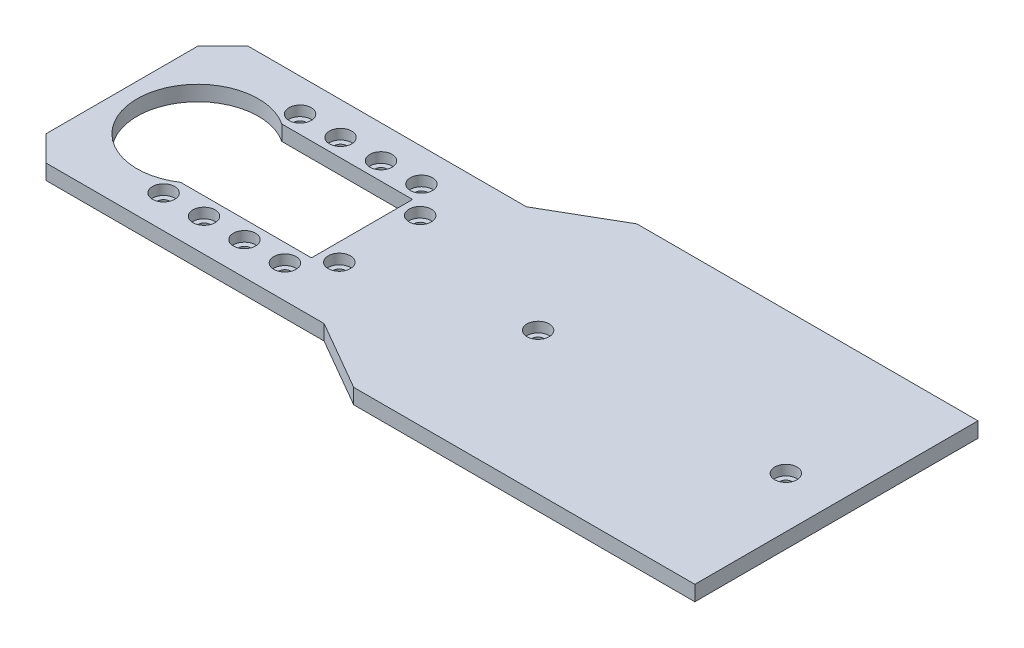
from build123d import *

# Parameters (mm, degrees)
EXTRUDE_1_DEPTH              = 3
CUT_EXTRUDE_1_REACH          = 217.134
HOLE_WIZARD_M2_2_D           = 2.4
HOLE_WIZARD_M2_2_CBORE_D     = 4.4
HOLE_WIZARD_M2_2_CBORE_DEPTH = 2
CUT_EXTRUDE_2_REACH          = 217.134
HOLE_WIZARD_M2_3_D           = 2.4
HOLE_WIZARD_M2_3_CBORE_D     = 4.4
HOLE_WIZARD_M2_3_CBORE_DEPTH = 2
MIRROR_7_COPY_1_REACH        = 217.134
MIRROR_7_COPY_2_D            = 2.4
MIRROR_7_COPY_2_CBORE_D      = 4.4
MIRROR_7_COPY_2_CBORE_DEPTH  = 2
CUT_EXTRUDE_3_REACH          = 217.134
SKETCH_18_W                  = 20
SKETCH_18_H                  = 10
HOLE_WIZARD_M2_4_D           = 2.4
HOLE_WIZARD_M2_4_CBORE_D     = 4.4
HOLE_WIZARD_M2_4_CBORE_DEPTH = 2
HOLE_WIZARD_M2_5_D           = 2.4
HOLE_WIZARD_M2_5_CBORE_D     = 4.4
HOLE_WIZARD_M2_5_CBORE_DEPTH = 2
HOLE_WIZARD_M2_6_D           = 2.4
HOLE_WIZARD_M2_6_CBORE_D     = 4.4
HOLE_WIZARD_M2_6_CBORE_DEPTH = 2
SKETCH_24_W                  = 20
SKETCH_24_H                  = 56
CUT_EXTRUDE_4_DEPTH          = 10
HOLE_WIZARD_M2_7_D           = 2.4
HOLE_WIZARD_M2_7_CBORE_D     = 4.4
HOLE_WIZARD_M2_7_CBORE_DEPTH = 2
SKETCH_26_OUTSIDE_W          = 390.69
SKETCH_26_OUTSIDE_H          = 393.83
SKETCH_26_OUTSIDE_W_2        = 151.320508076
SKETCH_26_OUTSIDE_H_2        = 56
CUT_EXTRUDE_6_DEPTH          = 10


with BuildPart() as part:
    # 草图1 → 凸台-拉伸1 (new body)
    with BuildSketch(Plane(origin=(0, 0, 0), x_dir=(1, 0, 0), z_dir=(0, 1, 0))):
        Polygon((-45.715728753, 114), (45.715728753, 114), (84.606601718, 152.890872965), (91.67766953, 152.890872965), (112.890872965, 131.67766953), (112.890872965, 124.606601718), (74, 85.715728753), (74, 30), (91.320508076, 20), (146.320508076, 20), (151.320508076, 15), (151.320508076, -15), (146.320508076, -20), (91.320508076, -20), (74, -30), (74, -85.715728753), (112.890872965, -124.606601718), (112.890872965, -131.67766953), (91.67766953, -152.890872965), (84.606601718, -152.890872965), (45.715728753, -114), (-45.715728753, -114), (-84.606601718, -152.890872965), (-91.67766953, -152.890872965), (-112.890872965, -131.67766953), (-112.890872965, -124.606601718), (-74, -85.715728753), (-74, -30), (-91.320508076, -20), (-146.320508076, -20), (-151.320508076, -15), (-151.320508076, 15), (-146.320508076, 20), (-91.320508076, 20), (-74, 30), (-74, 85.715728753), (-112.890872965, 124.606601718), (-112.890872965, 131.67766953), (-91.67766953, 152.890872965), (-84.606601718, 152.890872965), align=None)
    extrude(amount=EXTRUDE_1_DEPTH)

    # 草图2 → 切除-拉伸1 (cut, up to next)
    with BuildSketch(Plane(origin=(0, 3, 0), x_dir=(1, 0, 0), z_dir=(0, 1, 0)), mode=Mode.PRIVATE) as cut_extrude_1_sk1:
        with BuildLine():
            Line((103.820508076, -10), (103.820508076, 10))
            Line((103.820508076, 10), (129.687258495, 10))
            ThreePointArc((129.687258495, 10), (148.320508076, 0), (129.687258495, -10))
            Line((129.687258495, -10), (103.820508076, -10))
        make_face()
    cut_extrude_1_tool1 = extrude(cut_extrude_1_sk1.sketch, amount=-CUT_EXTRUDE_1_REACH, mode=Mode.PRIVATE) & part.part
    cut_extrude_1 = cut_extrude_1_tool1.solids().sort_by_distance((125.74589, 3, 0))[0]
    add(cut_extrude_1, mode=Mode.SUBTRACT)

    # M2 凹头盖螺钉的柱形沉头孔2 (through all)
    with Locations(Plane(origin=(100.320508076, 3, -8), x_dir=(0, 0, 1), z_dir=(0, 1, 0))):
        with Locations((0, 0), (-5.5, 5.25), (-5.5, 13.25), (-5.5, 21.25), (-5.5, 29.25), (16, 0), (21.5, 5.25), (21.5, 13.25), (21.5, 21.25), (21.5, 29.25)):
            hole_wizard_m2_2 = CounterBoreHole(HOLE_WIZARD_M2_2_D / 2, HOLE_WIZARD_M2_2_CBORE_D / 2, HOLE_WIZARD_M2_2_CBORE_DEPTH)

    # 草图10 → 切除-拉伸2 (cut, up to next)
    with BuildSketch(Plane(origin=(0, 3, 0), x_dir=(1, 0, 0), z_dir=(0, 1, 0)), mode=Mode.PRIVATE) as cut_extrude_2_sk1:
        with BuildLine():
            Line((75.767766953, 101.625631329), (61.625631329, 115.767766953))
            Line((61.625631329, 115.767766953), (79.916185958, 134.058321582))
            ThreePointArc((79.916185958, 134.058321582), (100.162950904, 140.162950904), (94.058321582, 119.916185958))
            Line((94.058321582, 119.916185958), (75.767766953, 101.625631329))
        make_face()
    cut_extrude_2_tool1 = extrude(cut_extrude_2_sk1.sketch, amount=-CUT_EXTRUDE_2_REACH, mode=Mode.PRIVATE) & part.part
    cut_extrude_2 = cut_extrude_2_tool1.solids().sort_by_distance((84.200285, 3, -124.200285))[0]
    add(cut_extrude_2, mode=Mode.SUBTRACT)

    # M2 凹头盖螺钉的柱形沉头孔3 (through all)
    with Locations(Plane(origin=(60.388194462, 3, -119.480077554), x_dir=(0, 0, 1), z_dir=(0, 1, 0))):
        with Locations((0, 0), (-5.65685425, 5.65685425), (-11.313708499, 11.313708499), (-16.970562749, 16.970562749), (7.601397898, 0.176776695), (18.915106397, 11.490485194), (19.091883092, 19.091883092), (13.435028842, 24.748737342), (7.778174593, 30.405591591), (2.121320343, 36.062445841)):
            hole_wizard_m2_3 = CounterBoreHole(HOLE_WIZARD_M2_3_D / 2, HOLE_WIZARD_M2_3_CBORE_D / 2, HOLE_WIZARD_M2_3_CBORE_DEPTH)

    # 镜向5: 切除-拉伸1, M2 凹头盖螺钉的柱形沉头孔2 across plane
    add(cut_extrude_1.mirror(Plane(origin=(0, 0, 0), x_dir=(0, 0, 1), z_dir=(1, 0, 0))), mode=Mode.SUBTRACT)
    add(hole_wizard_m2_2.mirror(Plane(origin=(0, 0, 0), x_dir=(0, 0, 1), z_dir=(1, 0, 0))), mode=Mode.SUBTRACT)

    # 镜向6: 切除-拉伸2, M2 凹头盖螺钉的柱形沉头孔3 across plane
    add(cut_extrude_2.mirror(Plane(origin=(0, 0, 0), x_dir=(0, 0, 1), z_dir=(1, 0, 0))), mode=Mode.SUBTRACT)
    add(hole_wizard_m2_3.mirror(Plane(origin=(0, 0, 0), x_dir=(0, 0, 1), z_dir=(1, 0, 0))), mode=Mode.SUBTRACT)

    # 镜向7: 切除-拉伸2, M2 凹头盖螺钉的柱形沉头孔3 across plane
    add(cut_extrude_2.mirror(Plane.XY), mode=Mode.SUBTRACT)
    add(hole_wizard_m2_3.mirror(Plane.XY), mode=Mode.SUBTRACT)

    # 镜向7 copy 1 sketch → 镜向7 copy 1 (cut, up to next)
    with BuildSketch(Plane(origin=(0, 3, 0), x_dir=(-1, 0, 0), z_dir=(0, 1, 0)), mode=Mode.PRIVATE) as mirror_7_copy_1_sk1:
        with BuildLine():
            Line((75.767766953, 101.625631329), (61.625631329, 115.767766953))
            Line((61.625631329, 115.767766953), (79.916185958, 134.058321582))
            ThreePointArc((79.916185958, 134.058321582), (100.162950904, 140.162950904), (94.058321582, 119.916185958))
            Line((94.058321582, 119.916185958), (75.767766953, 101.625631329))
        make_face()
    mirror_7_copy_1_tool1 = extrude(mirror_7_copy_1_sk1.sketch, amount=-MIRROR_7_COPY_1_REACH, mode=Mode.PRIVATE) & part.part
    add(mirror_7_copy_1_tool1.solids().sort_by_distance((-84.200285, 3, 124.200285))[0], mode=Mode.SUBTRACT)

    # 镜向7 copy 2 (through all)
    with Locations(Plane(origin=(-60.388194462, 3, 119.480077554), x_dir=(0, 0, -1), z_dir=(0, 1, 0))):
        with Locations((0, 0), (-5.65685425, 5.65685425), (-11.313708499, 11.313708499), (-16.970562749, 16.970562749), (7.601397898, 0.176776695), (18.915106397, 11.490485194), (19.091883092, 19.091883092), (13.435028842, 24.748737342), (7.778174593, 30.405591591), (2.121320343, 36.062445841)):
            CounterBoreHole(MIRROR_7_COPY_2_D / 2, MIRROR_7_COPY_2_CBORE_D / 2, MIRROR_7_COPY_2_CBORE_DEPTH)

    # 草图18 → 切除-拉伸3 (cut, up to next)
    with BuildSketch(Plane(origin=(0, 3, 0), x_dir=(1, 0, 0), z_dir=(0, 1, 0)), mode=Mode.PRIVATE) as cut_extrude_3_sk1:
        Polygon((-60, -28), (-15, -28), (-15, -63), (-60, -83), align=None)
    cut_extrude_3_tool1 = extrude(cut_extrude_3_sk1.sketch, amount=-CUT_EXTRUDE_3_REACH, mode=Mode.PRIVATE) & part.part
    # 草图18 → 切除-拉伸3 (cut, up to next)
    with BuildSketch(Plane(origin=(0, 3, 0), x_dir=(1, 0, 0), z_dir=(0, 1, 0)), mode=Mode.PRIVATE) as cut_extrude_3_sk2:
        with Locations((20, -99)):
            Rectangle(SKETCH_18_W, SKETCH_18_H)
    cut_extrude_3_tool2 = extrude(cut_extrude_3_sk2.sketch, amount=-CUT_EXTRUDE_3_REACH, mode=Mode.PRIVATE) & part.part
    # 草图18 → 切除-拉伸3 (cut, up to next)
    with BuildSketch(Plane(origin=(0, 3, 0), x_dir=(1, 0, 0), z_dir=(0, 1, 0)), mode=Mode.PRIVATE) as cut_extrude_3_sk3:
        with Locations((-20, -99)):
            Rectangle(SKETCH_18_W, SKETCH_18_H)
    cut_extrude_3_tool3 = extrude(cut_extrude_3_sk3.sketch, amount=-CUT_EXTRUDE_3_REACH, mode=Mode.PRIVATE) & part.part
    # 草图18 → 切除-拉伸3 (cut, up to next)
    with BuildSketch(Plane(origin=(0, 3, 0), x_dir=(1, 0, 0), z_dir=(0, 1, 0)), mode=Mode.PRIVATE) as cut_extrude_3_sk4:
        Polygon((15, -63), (60, -83), (60, -28), (15, -28), align=None)
    cut_extrude_3_tool4 = extrude(cut_extrude_3_sk4.sketch, amount=-CUT_EXTRUDE_3_REACH, mode=Mode.PRIVATE) & part.part
    # 草图18 → 切除-拉伸3 (cut, up to next)
    with BuildSketch(Plane(origin=(0, 3, 0), x_dir=(1, 0, 0), z_dir=(0, 1, 0)), mode=Mode.PRIVATE) as cut_extrude_3_sk5:
        with Locations((-20, 99)):
            Rectangle(SKETCH_18_W, SKETCH_18_H)
    cut_extrude_3_tool5 = extrude(cut_extrude_3_sk5.sketch, amount=-CUT_EXTRUDE_3_REACH, mode=Mode.PRIVATE) & part.part
    # 草图18 → 切除-拉伸3 (cut, up to next)
    with BuildSketch(Plane(origin=(0, 3, 0), x_dir=(1, 0, 0), z_dir=(0, 1, 0)), mode=Mode.PRIVATE) as cut_extrude_3_sk6:
        with Locations((20, 99)):
            Rectangle(SKETCH_18_W, SKETCH_18_H)
    cut_extrude_3_tool6 = extrude(cut_extrude_3_sk6.sketch, amount=-CUT_EXTRUDE_3_REACH, mode=Mode.PRIVATE) & part.part
    # 草图18 → 切除-拉伸3 (cut, up to next)
    with BuildSketch(Plane(origin=(0, 3, 0), x_dir=(1, 0, 0), z_dir=(0, 1, 0)), mode=Mode.PRIVATE) as cut_extrude_3_sk7:
        Polygon((15, 63), (60, 83), (60, 28), (15, 28), align=None)
    cut_extrude_3_tool7 = extrude(cut_extrude_3_sk7.sketch, amount=-CUT_EXTRUDE_3_REACH, mode=Mode.PRIVATE) & part.part
    # 草图18 → 切除-拉伸3 (cut, up to next)
    with BuildSketch(Plane(origin=(0, 3, 0), x_dir=(1, 0, 0), z_dir=(0, 1, 0)), mode=Mode.PRIVATE) as cut_extrude_3_sk8:
        Polygon((-15, 28), (-15, 63), (-60, 83), (-60, 28), align=None)
    cut_extrude_3_tool8 = extrude(cut_extrude_3_sk8.sketch, amount=-CUT_EXTRUDE_3_REACH, mode=Mode.PRIVATE) & part.part
    add(cut_extrude_3_tool1.solids().sort_by_distance((-39.166667, 3, 50.87037))[0], mode=Mode.SUBTRACT)
    add(cut_extrude_3_tool2.solids().sort_by_distance((20, 3, 99))[0], mode=Mode.SUBTRACT)
    add(cut_extrude_3_tool3.solids().sort_by_distance((-20, 3, 99))[0], mode=Mode.SUBTRACT)
    add(cut_extrude_3_tool4.solids().sort_by_distance((39.166667, 3, 50.87037))[0], mode=Mode.SUBTRACT)
    add(cut_extrude_3_tool5.solids().sort_by_distance((-20, 3, -99))[0], mode=Mode.SUBTRACT)
    add(cut_extrude_3_tool6.solids().sort_by_distance((20, 3, -99))[0], mode=Mode.SUBTRACT)
    add(cut_extrude_3_tool7.solids().sort_by_distance((39.166667, 3, -50.87037))[0], mode=Mode.SUBTRACT)
    add(cut_extrude_3_tool8.solids().sort_by_distance((-39.166667, 3, -50.87037))[0], mode=Mode.SUBTRACT)

    # M2 凹头盖螺钉的柱形沉头孔4 (through all)
    with Locations(Plane(origin=(-20, 3, 109), x_dir=(0, 0, 1), z_dir=(0, 1, 0))):
        with Locations((0, 0), (0, 40), (-218, 0), (-218, 40)):
            CounterBoreHole(HOLE_WIZARD_M2_4_D / 2, HOLE_WIZARD_M2_4_CBORE_D / 2, HOLE_WIZARD_M2_4_CBORE_DEPTH)

    # M2 凹头盖螺钉的柱形沉头孔5 (through all)
    with Locations(Plane(origin=(-69, 3, -40), x_dir=(0, 0, 1), z_dir=(0, 1, 0))):
        with Locations((0, 0), (0, 138)):
            hole_wizard_m2_5 = CounterBoreHole(HOLE_WIZARD_M2_5_D / 2, HOLE_WIZARD_M2_5_CBORE_D / 2, HOLE_WIZARD_M2_5_CBORE_DEPTH)

    # 镜向8: M2 凹头盖螺钉的柱形沉头孔5 across plane
    add(hole_wizard_m2_5.mirror(Plane.XY), mode=Mode.SUBTRACT)

    # M2 凹头盖螺钉的柱形沉头孔6 (through all)
    with Locations(Plane(origin=(-69, 3, 0), x_dir=(0, 0, 1), z_dir=(0, 1, 0))):
        with Locations((0, 0), (0, 138)):
            CounterBoreHole(HOLE_WIZARD_M2_6_D / 2, HOLE_WIZARD_M2_6_CBORE_D / 2, HOLE_WIZARD_M2_6_CBORE_DEPTH)

    # 草图24 → 切除-拉伸4 (cut)
    with BuildSketch(Plane(origin=(0, 3, 0), x_dir=(1, 0, 0), z_dir=(0, 1, 0))):
        Rectangle(SKETCH_24_W, SKETCH_24_H)
    extrude(amount=-CUT_EXTRUDE_4_DEPTH, mode=Mode.SUBTRACT)

    # M2 凹头盖螺钉的柱形沉头孔7 (through all)
    with Locations(Plane(origin=(-20, 3, 0), x_dir=(0, 0, 1), z_dir=(0, 1, 0))):
        with Locations((0, 0), (0, 40)):
            CounterBoreHole(HOLE_WIZARD_M2_7_D / 2, HOLE_WIZARD_M2_7_CBORE_D / 2, HOLE_WIZARD_M2_7_CBORE_DEPTH)

    # 草图26 outside → 切除-拉伸6 (cut)
    with BuildSketch(Plane(origin=(0, 3, 0), x_dir=(1, 0, 0), z_dir=(0, 1, 0))):
        Rectangle(SKETCH_26_OUTSIDE_W, SKETCH_26_OUTSIDE_H)
        with Locations((-75.660254038, 0)):
            Rectangle(SKETCH_26_OUTSIDE_W_2, SKETCH_26_OUTSIDE_H_2, mode=Mode.SUBTRACT)
    extrude(amount=-CUT_EXTRUDE_6_DEPTH, mode=Mode.SUBTRACT)


solid = part.part
